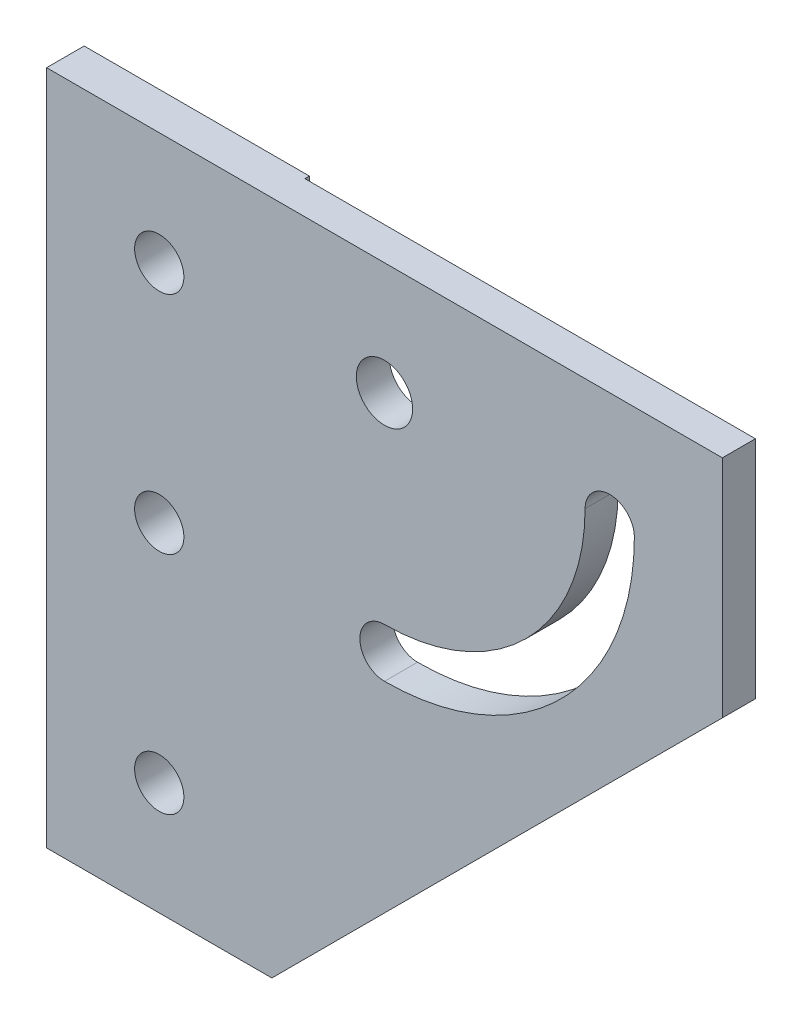
from build123d import *

# Parameters (mm, degrees)
BOSS_EXTRUDE1_DEPTH      = 5.588
SKETCH2_W                = 38.1
SKETCH2_H                = 114.3
BOSS_EXTRUDE2_DEPTH      = 0.762
CUT_EXTRUDE1_DEPTH       = 89.325143098
HOLE1_D                  = 8.3312
HOLE2_D                  = 8.3312
HOLE3_D                  = 8.3312
M8_CLEARANCE_HOLE1_D     = 9.525
M8_CLEARANCE_HOLE1_DEPTH = 6.350025


with BuildPart() as part:
    # Sketch1 → Boss-Extrude1 (new body)
    with BuildSketch(Plane.XY.offset(0.368365902)):
        Polygon((65.226818068, 55.007779903), (-49.073181932, 55.007779903), (-49.073181932, -59.292220097), (-10.973181932, -59.292220097), (65.226818068, 16.907779903), align=None)
    extrude(amount=-BOSS_EXTRUDE1_DEPTH)

    # Sketch2 → Boss-Extrude2 (add)
    with BuildSketch(Plane(origin=(0, 0, -5.219634098), x_dir=(-1, 0, 0), z_dir=(0, 0, -1))):
        with Locations((30.023181932, -2.142220097)):
            Rectangle(SKETCH2_W, SKETCH2_H)
    extrude(amount=BOSS_EXTRUDE2_DEPTH)

    # Sketch3 → Cut-Extrude1 (cut, through all)
    with BuildSketch(Plane(origin=(0, 0, -5.219634098), x_dir=(-1, 0, 0), z_dir=(0, 0, -1))):
        with BuildLine():
            ThreePointArc((-42.011218068, 35.957779903), (-46.176818068, 40.123379903), (-50.342418068, 35.957779903))
            ThreePointArc((-50.342418068, 35.957779903), (-37.963110439, 6.071487532), (-8.076818068, -6.307820097))
            ThreePointArc((-8.076818068, -6.307820097), (-3.911218068, -2.142220097), (-8.076818068, 2.023379903))
            ThreePointArc((-8.076818068, 2.023379903), (-32.072062423, 11.962535547), (-42.011218068, 35.957779903))
        make_face()
    extrude(amount=-CUT_EXTRUDE1_DEPTH, mode=Mode.SUBTRACT)

    # Hole1 (through all)
    with Locations(Plane(origin=(0, 0, -5.981634098), x_dir=(-1, 0, 0), z_dir=(0, 0, -1))):
        with Locations((30.023181932, -2.142220097)):
            Hole(HOLE1_D / 2)

    # Hole2 (through all)
    with Locations(Plane(origin=(0, 0, -5.981634098), x_dir=(-1, 0, 0), z_dir=(0, 0, -1))):
        with Locations((30.023181932, 35.957779903)):
            Hole(HOLE2_D / 2)

    # Hole3 (through all)
    with Locations(Plane(origin=(0, 0, -5.981634098), x_dir=(-1, 0, 0), z_dir=(0, 0, -1))):
        with Locations((30.023181932, -40.242220097)):
            Hole(HOLE3_D / 2)

    # M8 Clearance Hole1
    with Locations(Plane.XY.offset(0.368365902)):
        with Locations((8.076818068, 35.957779903)):
            Hole(M8_CLEARANCE_HOLE1_D / 2, depth=M8_CLEARANCE_HOLE1_DEPTH)


solid = part.part
